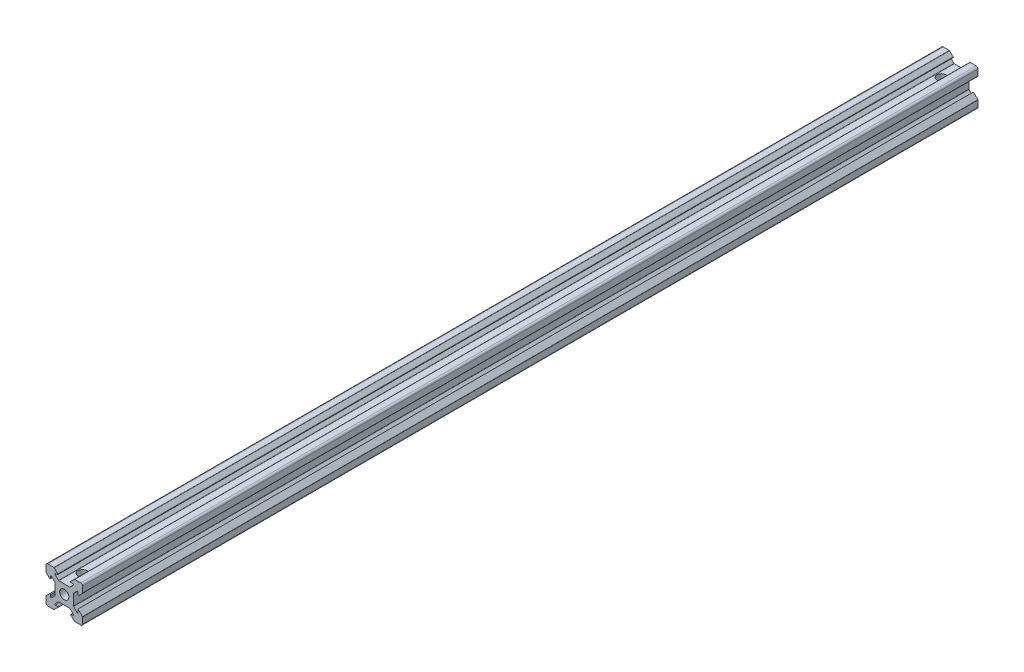
from build123d import *

# Parameters (mm, degrees)
CROQUIS11_R                = 2.5
MIEMBRO_ESTRUCTURAL1_DEPTH = 490
CROQUIS12_R                = 2.5
CORTAR_EXTRUIR1_DEPTH      = 12


with BuildPart() as part:
    # Croquis11 → Miembro estructural1 (new body)
    with BuildSketch(Plane.XY.offset(-245)):
        with BuildLine():
            Line((-9, -10), (-5.713990218, -10))
            ThreePointArc((-5.713990218, -10), (-5.599185189, -9.97716386), (-5.501858184, -9.912132034))
            Line((-5.501858184, -9.912132034), (-3.612132034, -8.022405885))
            ThreePointArc((-3.612132034, -8.022405885), (-3.547100209, -7.695468821), (-3.824264069, -7.51027385))
            Line((-3.824264069, -7.51027385), (-4.847118775, -7.51027385))
            ThreePointArc((-4.847118775, -7.51027385), (-5.124282635, -7.32507888), (-5.059250809, -6.998141816))
            Line((-5.059250809, -6.998141816), (-3.16952466, -5.108415666))
            ThreePointArc((-3.16952466, -5.108415666), (-3.072197655, -5.043383841), (-2.957392625, -5.0205477))
            Line((-2.957392625, -5.0205477), (2.957392625, -5.0205477))
            ThreePointArc((2.957392625, -5.0205477), (3.072197655, -5.043383841), (3.16952466, -5.108415666))
            Line((3.16952466, -5.108415666), (5.059250809, -6.998141816))
            ThreePointArc((5.059250809, -6.998141816), (5.124282635, -7.32507888), (4.847118775, -7.51027385))
            Line((4.847118775, -7.51027385), (3.824264069, -7.51027385))
            ThreePointArc((3.824264069, -7.51027385), (3.547100209, -7.695468821), (3.612132034, -8.022405885))
            Line((3.612132034, -8.022405885), (5.501858184, -9.912132034))
            ThreePointArc((5.501858184, -9.912132034), (5.599185189, -9.97716386), (5.713990218, -10))
            Line((5.713990218, -10), (9, -10))
            ThreePointArc((9, -10), (9.707106781, -9.707106781), (10, -9))
            Line((10, -9), (10, -5.713990218))
            ThreePointArc((10, -5.713990218), (9.97716386, -5.599185189), (9.912132034, -5.501858184))
            Line((9.912132034, -5.501858184), (7.51027385, -3.1))
            Line((7.51027385, -3.1), (7.51027385, -4.847118775))
            ThreePointArc((7.51027385, -4.847118775), (7.32507888, -5.124282635), (6.998141816, -5.059250809))
            Line((6.998141816, -5.059250809), (5.108415666, -3.16952466))
            ThreePointArc((5.108415666, -3.16952466), (5.043383841, -3.072197655), (5.0205477, -2.957392625))
            Line((5.0205477, -2.957392625), (5.0205477, 2.957392625))
            ThreePointArc((5.0205477, 2.957392625), (5.043383841, 3.072197655), (5.108415666, 3.16952466))
            Line((5.108415666, 3.16952466), (6.998141816, 5.059250809))
            ThreePointArc((6.998141816, 5.059250809), (7.32507888, 5.124282635), (7.51027385, 4.847118775))
            Line((7.51027385, 4.847118775), (7.51027385, 3.824264069))
            ThreePointArc((7.51027385, 3.824264069), (7.695468821, 3.547100209), (8.022405885, 3.612132034))
            Line((8.022405885, 3.612132034), (9.912132034, 5.501858184))
            ThreePointArc((9.912132034, 5.501858184), (9.97716386, 5.599185189), (10, 5.713990218))
            Line((10, 5.713990218), (10, 9))
            ThreePointArc((10, 9), (9.707106781, 9.707106781), (9, 10))
            Line((9, 10), (5.713990218, 10))
            ThreePointArc((5.713990218, 10), (5.599185189, 9.97716386), (5.501858184, 9.912132034))
            Line((5.501858184, 9.912132034), (3.1, 7.51027385))
            Line((3.1, 7.51027385), (4.847118775, 7.51027385))
            ThreePointArc((4.847118775, 7.51027385), (5.124282635, 7.32507888), (5.059250809, 6.998141816))
            Line((5.059250809, 6.998141816), (3.16952466, 5.108415666))
            ThreePointArc((3.16952466, 5.108415666), (3.072197655, 5.043383841), (2.957392625, 5.0205477))
            Line((2.957392625, 5.0205477), (-2.957392625, 5.0205477))
            ThreePointArc((-2.957392625, 5.0205477), (-3.072197655, 5.043383841), (-3.16952466, 5.108415666))
            Line((-3.16952466, 5.108415666), (-5.059250809, 6.998141816))
            ThreePointArc((-5.059250809, 6.998141816), (-5.124282635, 7.32507888), (-4.847118775, 7.51027385))
            Line((-4.847118775, 7.51027385), (-3.824264069, 7.51027385))
            ThreePointArc((-3.824264069, 7.51027385), (-3.547100209, 7.695468821), (-3.612132034, 8.022405885))
            Line((-3.612132034, 8.022405885), (-5.501858184, 9.912132034))
            ThreePointArc((-5.501858184, 9.912132034), (-5.599185189, 9.97716386), (-5.713990218, 10))
            Line((-5.713990218, 10), (-9, 10))
            ThreePointArc((-9, 10), (-9.707106781, 9.707106781), (-10, 9))
            Line((-10, 9), (-10, 5.713990218))
            ThreePointArc((-10, 5.713990218), (-9.97716386, 5.599185189), (-9.912132034, 5.501858184))
            Line((-9.912132034, 5.501858184), (-8.022405885, 3.612132034))
            ThreePointArc((-8.022405885, 3.612132034), (-7.695468821, 3.547100209), (-7.51027385, 3.824264069))
            Line((-7.51027385, 3.824264069), (-7.51027385, 4.847118775))
            ThreePointArc((-7.51027385, 4.847118775), (-7.32507888, 5.124282635), (-6.998141816, 5.059250809))
            Line((-6.998141816, 5.059250809), (-5.108415666, 3.16952466))
            ThreePointArc((-5.108415666, 3.16952466), (-5.043383841, 3.072197655), (-5.0205477, 2.957392625))
            Line((-5.0205477, 2.957392625), (-5.0205477, -2.957392625))
            ThreePointArc((-5.0205477, -2.957392625), (-5.043383841, -3.072197655), (-5.108415666, -3.16952466))
            Line((-5.108415666, -3.16952466), (-6.998141816, -5.059250809))
            ThreePointArc((-6.998141816, -5.059250809), (-7.32507888, -5.124282635), (-7.51027385, -4.847118775))
            Line((-7.51027385, -4.847118775), (-7.51027385, -3.824264069))
            ThreePointArc((-7.51027385, -3.824264069), (-7.695468821, -3.547100209), (-8.022405885, -3.612132034))
            Line((-8.022405885, -3.612132034), (-9.912132034, -5.501858184))
            ThreePointArc((-9.912132034, -5.501858184), (-9.97716386, -5.599185189), (-10, -5.713990218))
            Line((-10, -5.713990218), (-10, -9))
            ThreePointArc((-10, -9), (-9.707106781, -9.707106781), (-9, -10))
        make_face()
        Circle(CROQUIS11_R, mode=Mode.SUBTRACT)
    extrude(amount=MIEMBRO_ESTRUCTURAL1_DEPTH)

    # Croquis12 → Cortar-Extruir1 (cut)
    with BuildSketch(Plane(origin=(0, 5.0205477, 0), x_dir=(1, 0, 0), z_dir=(0, 1, 0))):
        with Locations(Location((0, 235, 0), (0, 0, 180))):
            Circle(CROQUIS12_R)
        with Locations(Location((0, -235, 0), (0, 0, 180))):
            Circle(CROQUIS12_R)
    extrude(amount=-CORTAR_EXTRUIR1_DEPTH, mode=Mode.SUBTRACT)


solid = part.part
